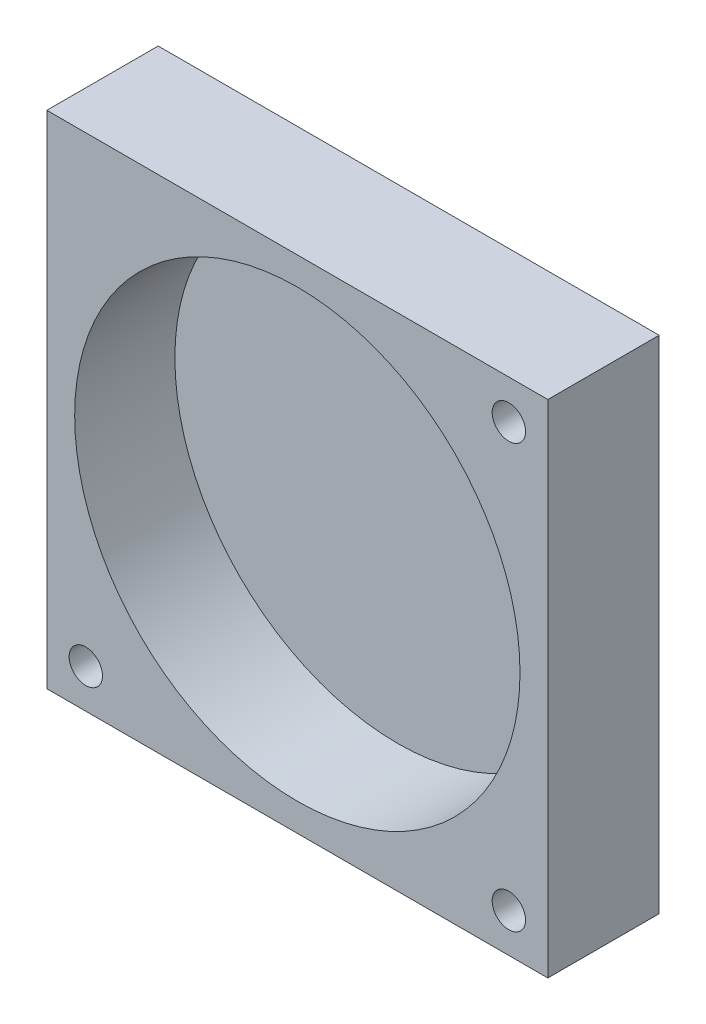
from build123d import *

# Parameters (mm, degrees)
SKETCH_1_W      = 45
SKETCH_1_H      = 45
SKETCH_1_R      = 1.5
SKETCH_1_R_2    = 20
EXTRUDE_1_DEPTH = 10
SKETCH_2_R      = 20
EXTRUDE_2_DEPTH = 1


with BuildPart() as part:
    # 草圖1 → 填料-伸長1 (new body)
    with BuildSketch(Plane.XY):
        Rectangle(SKETCH_1_W, SKETCH_1_H)
        with Locations((19, 19)):
            Circle(SKETCH_1_R, mode=Mode.SUBTRACT)
        with Locations((19, -19)):
            Circle(SKETCH_1_R, mode=Mode.SUBTRACT)
        with Locations((-19, -19)):
            Circle(SKETCH_1_R, mode=Mode.SUBTRACT)
        Circle(SKETCH_1_R_2, mode=Mode.SUBTRACT)
    extrude(amount=EXTRUDE_1_DEPTH)

    # 草圖2 → 填料-伸長2 (add)
    with BuildSketch(Plane(origin=(0, 0, 0), x_dir=(-1, 0, 0), z_dir=(0, 0, -1))):
        Circle(SKETCH_2_R)
    extrude(amount=-EXTRUDE_2_DEPTH)


solid = part.part
